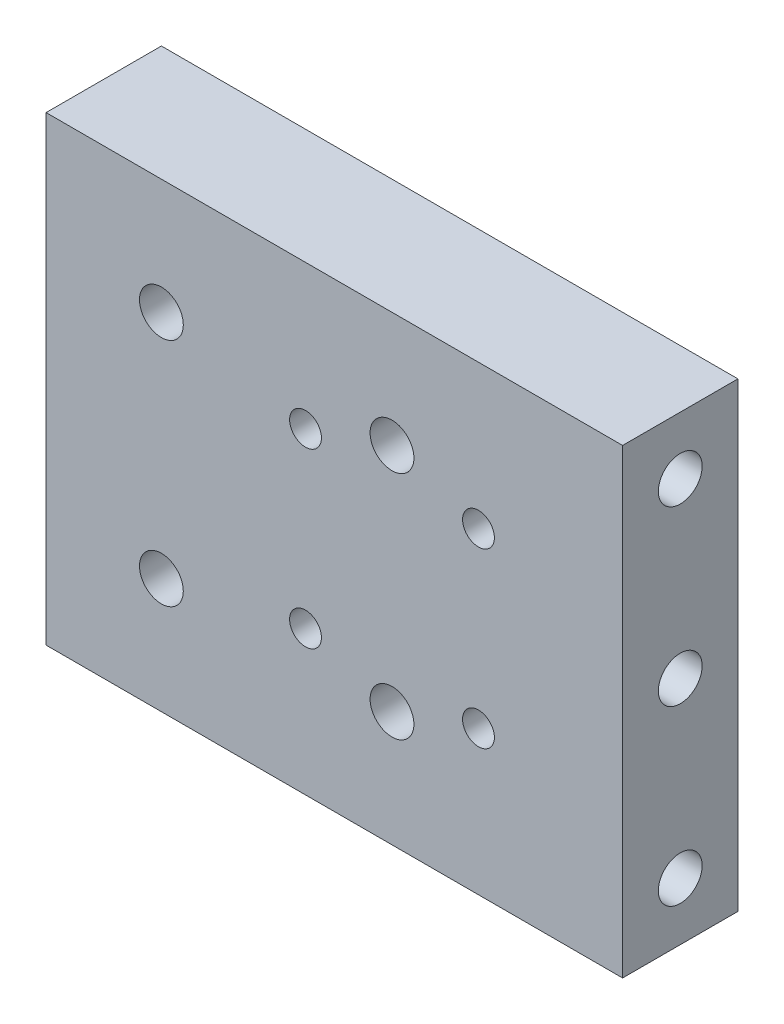
from build123d import *

# Parameters (mm, degrees)
SKETCH1_W                = 63.5
SKETCH1_H                = 50.8
BOSS_EXTRUDE1_DEPTH      = 6.35
F_10_32_THREADED_D       = 4.826
F_10_32_THREADED_FRONT_D = 4.826
F_6_32_THREADED_FRONT_D  = 3.5052


with BuildPart() as part:
    # Sketch1 → Boss-Extrude1 (new, symmetric)
    with BuildSketch(Plane.XY):
        with Locations((-31.75, 25.4)):
            Rectangle(SKETCH1_W, SKETCH1_H)
    extrude(amount=BOSS_EXTRUDE1_DEPTH, both=True)

    # #10-32 Threaded (through all)
    with Locations(Plane(origin=(0, 0, 0), x_dir=(0, 0, -1), z_dir=(1, 0, 0))):
        with Locations((0, 44.45), (0, 25.4), (0, 6.35)):
            Hole(F_10_32_THREADED_D / 2)

    # #10-32 Threaded Front (through all)
    with Locations(Plane.XY.offset(6.35)):
        with Locations((-50.8, 38.1), (-25.4, 38.1), (-50.8, 12.7), (-25.4, 12.7)):
            Hole(F_10_32_THREADED_FRONT_D / 2)

    # #6-32 Threaded Front (through all)
    with Locations(Plane.XY.offset(6.35)):
        with Locations((-34.925, 34.925), (-15.875, 34.925), (-15.875, 15.875), (-34.925, 15.875)):
            Hole(F_6_32_THREADED_FRONT_D / 2)


solid = part.part
